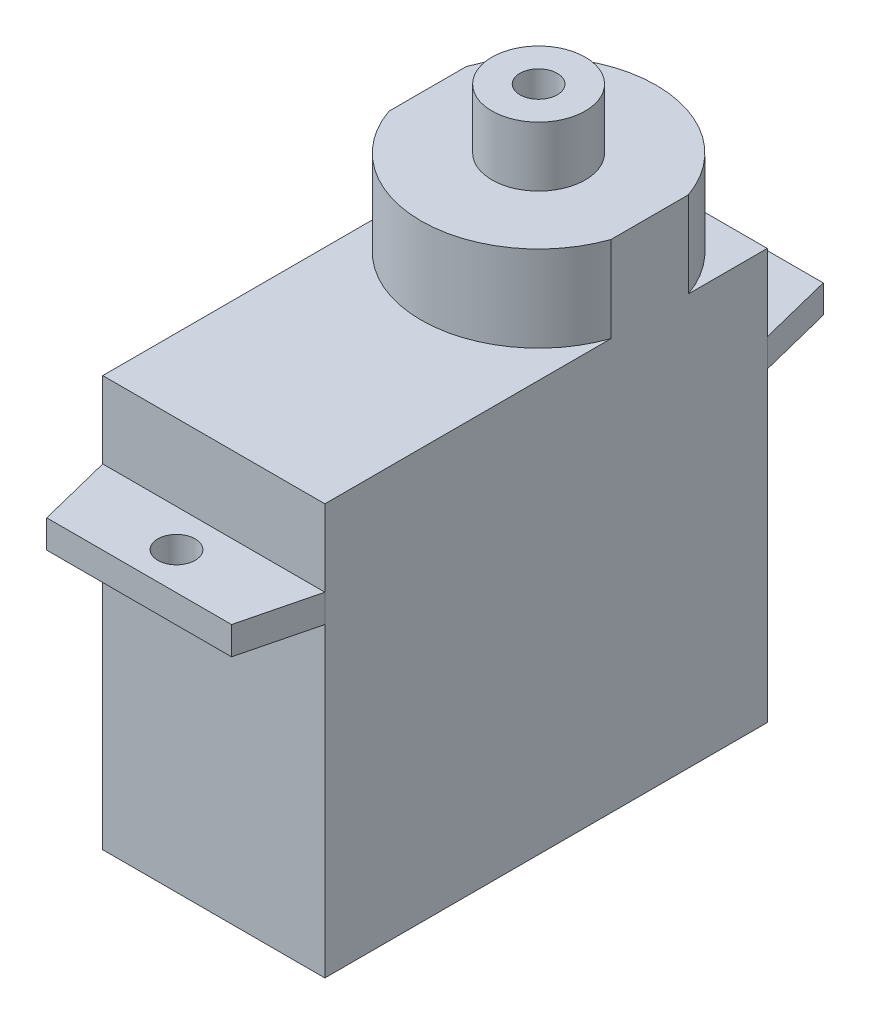
from build123d import *

# Parameters (mm, degrees)
SKETCH_1_W      = 11.9
SKETCH_1_H      = 23.7
EXTRUDE_1_DEPTH = 16.4
SKETCH_2_R      = 1
EXTRUDE_2_DEPTH = 1.5
SKETCH_3_W      = 11.9
SKETCH_3_H      = 23.7
EXTRUDE_3_DEPTH = 4.1
EXTRUDE_4_DEPTH = 4.6
SKETCH_5_R      = 2.5
SKETCH_5_R_2    = 1
EXTRUDE_5_DEPTH = 3.2


with BuildPart() as part:
    # 草图1 → 凸台-拉伸1 (new body)
    with BuildSketch(Plane(origin=(0, 0, 0), x_dir=(1, 0, 0), z_dir=(0, 1, 0))):
        Rectangle(SKETCH_1_W, SKETCH_1_H)
    extrude(amount=EXTRUDE_1_DEPTH)

    # 草图2 → 凸台-拉伸2 (add)
    with BuildSketch(Plane(origin=(0, 16.4, 0), x_dir=(1, 0, 0), z_dir=(0, 1, 0))):
        Polygon((-5.95, 11.85), (-4.95, 15.85), (4.95, 15.85), (5.95, 11.85), (5.95, -11.85), (4.95, -15.85), (-4.95, -15.85), (-5.95, -11.85), align=None)
        with Locations(Location((0, 13.85, 0), (0, 0, 270))):
            Circle(SKETCH_2_R, mode=Mode.SUBTRACT)
        with Locations(Location((0, -13.85, 0), (0, 0, 270))):
            Circle(SKETCH_2_R, mode=Mode.SUBTRACT)
    extrude(amount=EXTRUDE_2_DEPTH)

    # 草图3 → 凸台-拉伸3 (add)
    with BuildSketch(Plane(origin=(0, 17.9, 0), x_dir=(1, 0, 0), z_dir=(0, 1, 0))):
        Rectangle(SKETCH_3_W, SKETCH_3_H)
    extrude(amount=EXTRUDE_3_DEPTH)

    # 草图4 → 凸台-拉伸4 (add)
    with BuildSketch(Plane(origin=(0, 22, 0), x_dir=(1, 0, 0), z_dir=(0, 1, 0))):
        with BuildLine():
            Line((-5.95, 7.620627924), (-5.95, 3.479372076))
            ThreePointArc((-5.95, 3.479372076), (0, -0.75), (5.95, 3.479372076))
            Line((5.95, 3.479372076), (5.95, 7.620627924))
            ThreePointArc((5.95, 7.620627924), (0, 11.85), (-5.95, 7.620627924))
        make_face()
    extrude(amount=EXTRUDE_4_DEPTH)

    # 草图5 → 凸台-拉伸5 (add)
    with BuildSketch(Plane(origin=(0, 26.6, 0), x_dir=(1, 0, 0), z_dir=(0, 1, 0))):
        with Locations(Location((0, 5.55, 0), (0, 0, 90))):
            Circle(SKETCH_5_R)
        with Locations(Location((0, 5.55, 0), (0, 0, 90))):
            Circle(SKETCH_5_R_2, mode=Mode.SUBTRACT)
    extrude(amount=EXTRUDE_5_DEPTH)


solid = part.part
